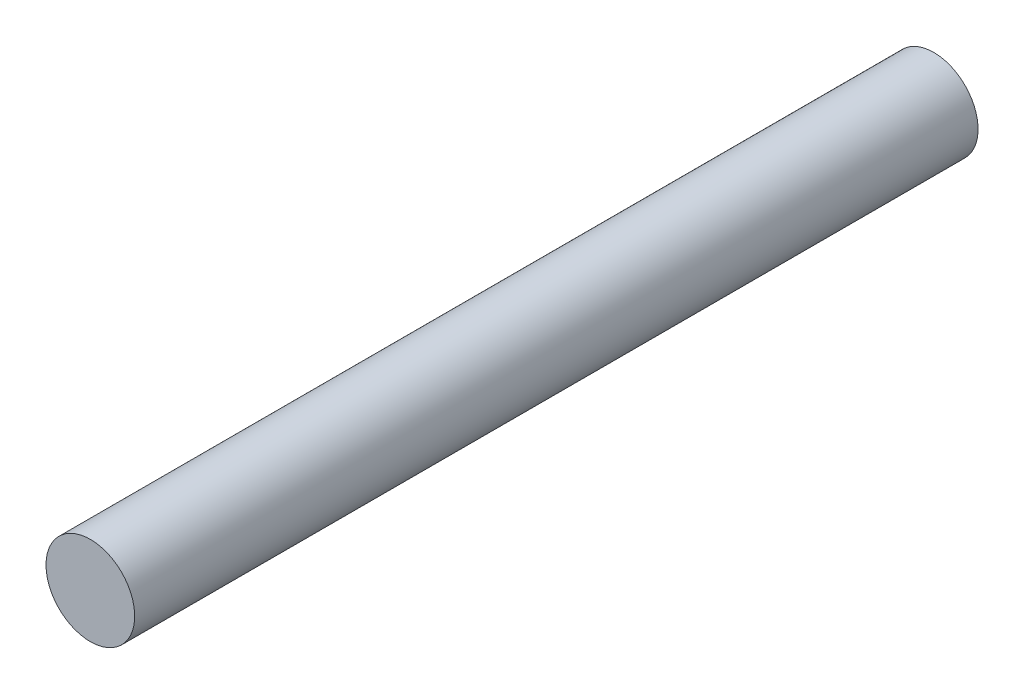
from build123d import *

# Parameters (mm, degrees)
SKETCH1_R           = 5
BOSS_EXTRUDE1_DEPTH = 95.1


with BuildPart() as part:
    # Sketch1 → Boss-Extrude1 (new body)
    with BuildSketch(Plane.XY):
        with Locations(Location((0, 0, 0), (0, 0, 180))):
            Circle(SKETCH1_R)
    extrude(amount=BOSS_EXTRUDE1_DEPTH)


solid = part.part
